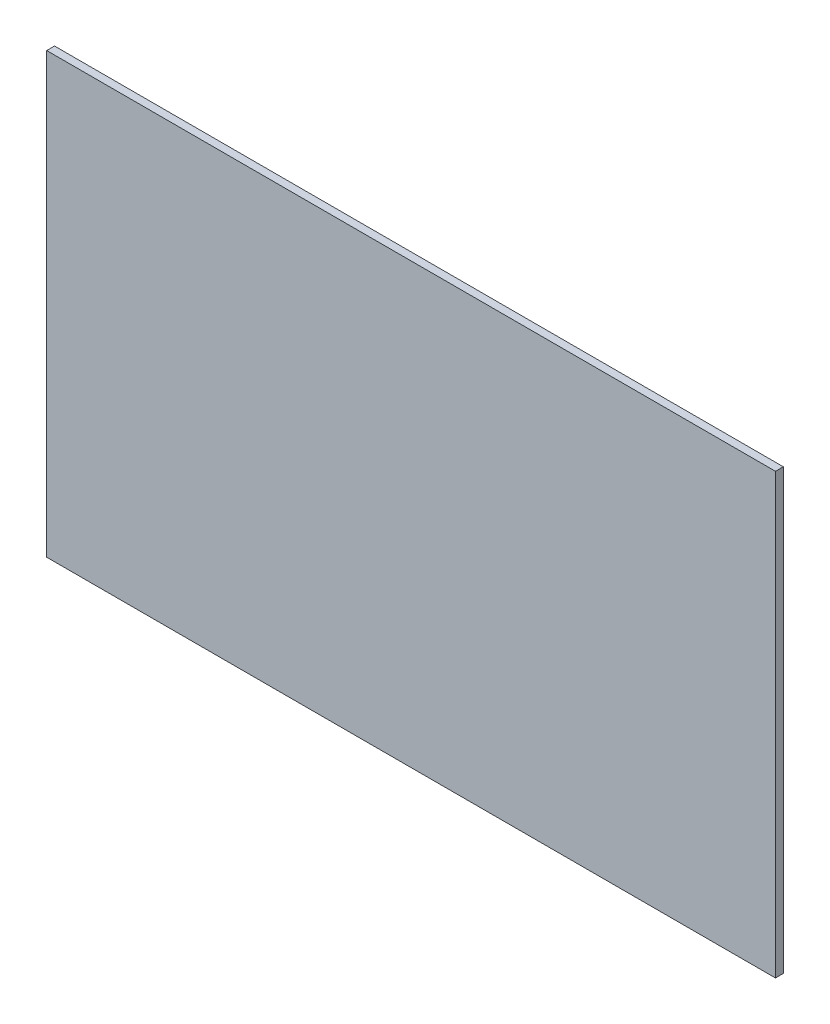
from build123d import *

# Parameters (mm, degrees)
SKETCH1_W           = 465
SKETCH1_H           = 280
BOSS_EXTRUDE1_DEPTH = 5


with BuildPart() as part:
    # Sketch1 → Boss-Extrude1 (new body)
    with BuildSketch(Plane.XY):
        with Locations((232.5, 140)):
            Rectangle(SKETCH1_W, SKETCH1_H)
    extrude(amount=BOSS_EXTRUDE1_DEPTH)


solid = part.part
